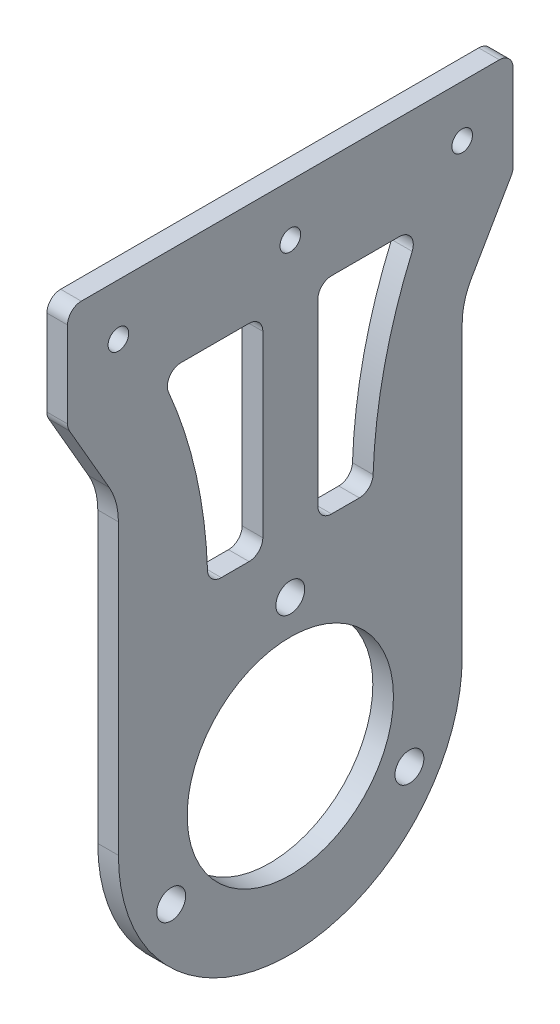
from build123d import *

# Parameters (mm, degrees)
SKETCH_1_R      = 15
SKETCH_1_R_2    = 2.1
SKETCH_1_R_3    = 1.5
EXTRUDE_1_DEPTH = 3
FILLET_2_R      = 2
FILLET_3_R      = 10


with BuildPart() as part:
    # 草图1 → 凸台-拉伸1 (new body)
    with BuildSketch(Plane(origin=(0, 0, 0), x_dir=(0, 0, -1), z_dir=(1, 0, 0))):
        with BuildLine():
            Line((-32.4, 72.5), (32.4, 72.5))
            Line((32.4, 72.5), (32.4, 57.5))
            Line((32.4, 57.5), (25, 44.682824024))
            Line((25, 44.682824024), (25, 0))
            ThreePointArc((25, 0), (0, -25), (-25, 0))
            Line((-25, 0), (-25, 44.682824024))
            Line((-25, 44.682824024), (-32.4, 57.5))
            Line((-32.4, 57.5), (-32.4, 72.5))
        make_face()
        Circle(SKETCH_1_R, mode=Mode.SUBTRACT)
        with Locations((0, 20)):
            Circle(SKETCH_1_R_2, mode=Mode.SUBTRACT)
        with Locations((17.320508076, -10)):
            Circle(SKETCH_1_R_2, mode=Mode.SUBTRACT)
        with Locations((-17.320508076, -10)):
            Circle(SKETCH_1_R_2, mode=Mode.SUBTRACT)
        with Locations((-25, 65)):
            Circle(SKETCH_1_R_3, mode=Mode.SUBTRACT)
        with Locations((0, 65)):
            Circle(SKETCH_1_R_3, mode=Mode.SUBTRACT)
        with Locations((25, 65)):
            Circle(SKETCH_1_R_3, mode=Mode.SUBTRACT)
        with BuildLine():
            Line((-19, 57.5), (-4, 57.5))
            Line((-4, 57.5), (-4, 27.5))
            Line((-4, 27.5), (-12, 27.5))
            ThreePointArc((-12, 27.5), (-13.829211823, 42.889850575), (-19, 57.5))
        make_face(mode=Mode.SUBTRACT)
        with BuildLine():
            Line((4, 27.5), (12, 27.5))
            ThreePointArc((12, 27.5), (13.829211823, 42.889850575), (19, 57.5))
            Line((19, 57.5), (4, 57.5))
            Line((4, 57.5), (4, 27.5))
        make_face(mode=Mode.SUBTRACT)
    extrude(amount=EXTRUDE_1_DEPTH)

    # 圆角2
    fillet_2_edges = [part.edges().sort_by_distance(p)[0] for p in [
        (1.5, 72.5, 32.4),
        (1.5, 72.5, -32.4),
        (1.5, 57.5, -32.4),
        (1.5, 57.5, 32.4),
        (1.5, 57.5, 19),
        (1.5, 27.5, 12),
        (1.5, 27.5, 4),
        (1.5, 57.5, 4),
        (1.5, 27.5, -12),
        (1.5, 57.5, -19),
        (1.5, 57.5, -4),
        (1.5, 27.5, -4),
    ]]
    fillet(fillet_2_edges, radius=FILLET_2_R)

    # 圆角3
    fillet_3_edges = [part.edges().sort_by_distance(p)[0] for p in [
        (1.5, 44.682824024, -25),
        (1.5, 44.682824024, 25),
    ]]
    fillet(fillet_3_edges, radius=FILLET_3_R)


solid = part.part
